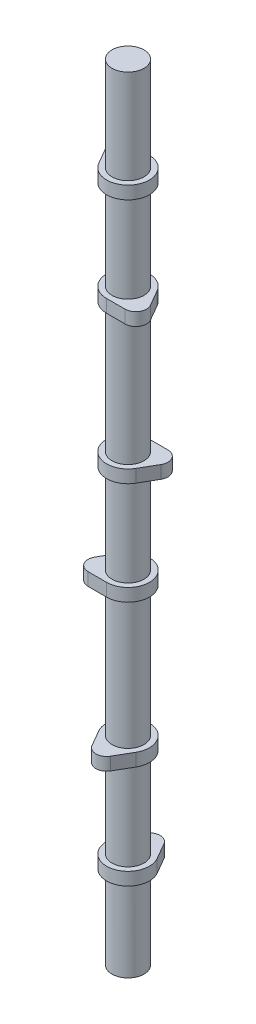
from build123d import *

# Parameters (mm, degrees)
BOSS_EXTRUDE1_DEPTH   = 96.774
BODY_MOVE_COPY2_ANGLE = 180
BOSS_EXTRUDE2_START   = -645.16
SKETCH3_R             = 241.3
BOSS_EXTRUDE2_DEPTH   = 3709.67
LPATTERN1_COUNT       = 3
LPATTERN1_PITCH       = 3709.67
BODY_MOVE_COPY3_ANGLE = 120
BODY_MOVE_COPY4_ANGLE = 120
BOSS_EXTRUDE3_START   = 709.676
SKETCH4_R             = 241.3
BOSS_EXTRUDE3_DEPTH   = 709.676
SCALE1_SCALE          = 0.039370079


with BuildPart() as part:
    # Sketch1 → Boss-Extrude1 (new, symmetric)
    with BuildSketch(Plane(origin=(0, 0, 0), x_dir=(1, 0, 0), z_dir=(0, 1, 0))):
        with BuildLine():
            Line((-139.681237376, 403.225), (-279.362474753, 161.29))
            ThreePointArc((-279.362474753, 161.29), (0, -322.58), (279.362474753, 161.29))
            Line((279.362474753, 161.29), (139.681237376, 403.225))
            ThreePointArc((139.681237376, 403.225), (0, 483.87), (-139.681237376, 403.225))
        make_face()
    extrude(amount=BOSS_EXTRUDE1_DEPTH, both=True)


with BuildPart() as body_2:
    # Body-Move/Copy1: copy of part
    add(part.part.moved(Location((0, 1548.384, 0))))


with BuildPart() as body_2_1:
    # Body-Move/Copy2: moved
    add(body_2.part.rotate(Axis((0, 0, 0), (0, 1, 0)), BODY_MOVE_COPY2_ANGLE))


with BuildPart() as part_1:
    add(part.part)

    add(body_2_1.part)  # Boss-Extrude2 merges body 2
    # Sketch3 → Boss-Extrude2 (add)
    with BuildSketch(Plane(origin=(0, 0, 0), x_dir=(1, 0, 0), z_dir=(0, 1, 0)).offset(BOSS_EXTRUDE2_START)):
        Circle(SKETCH3_R)
    extrude(amount=BOSS_EXTRUDE2_DEPTH)


with BuildPart() as lpattern1_1:
    # LPattern1: pattern copy
    add(part_1.part.moved(Location(Vector(0, 1, 0) * (1 * LPATTERN1_PITCH))))


with BuildPart() as lpattern1_2:
    # LPattern1: pattern copy
    add(part_1.part.moved(Location(Vector(0, 1, 0) * (2 * LPATTERN1_PITCH))))


with BuildPart() as lpattern1_1_1:
    # Body-Move/Copy3: moved
    add(lpattern1_1.part.rotate(Axis((0, 0, 0), (0, 1, 0)), BODY_MOVE_COPY3_ANGLE))


with BuildPart() as lpattern1_2_1:
    # Body-Move/Copy4: moved
    add(lpattern1_2.part.rotate(Axis((0, 0, 0), (0, -1, 0)), BODY_MOVE_COPY4_ANGLE))


with BuildPart() as part_2:
    add(part_1.part)

    # Sketch4 → Boss-Extrude3 (add)
    with BuildSketch(Plane.XZ.offset(645.16).offset(BOSS_EXTRUDE3_START)):
        Circle(SKETCH4_R)
    extrude(amount=-BOSS_EXTRUDE3_DEPTH)

    # Combine1: union LPattern1_1, LPattern1_2
    add(lpattern1_1_1.part)
    add(lpattern1_2_1.part)


with BuildPart() as part_3:
    # Scale1: scaled about (0, 4556.786138492, 0)
    add(part_2.part.scale(SCALE1_SCALE).moved(Location((0, 4377.385109418, 0))))


solid = part_3.part
